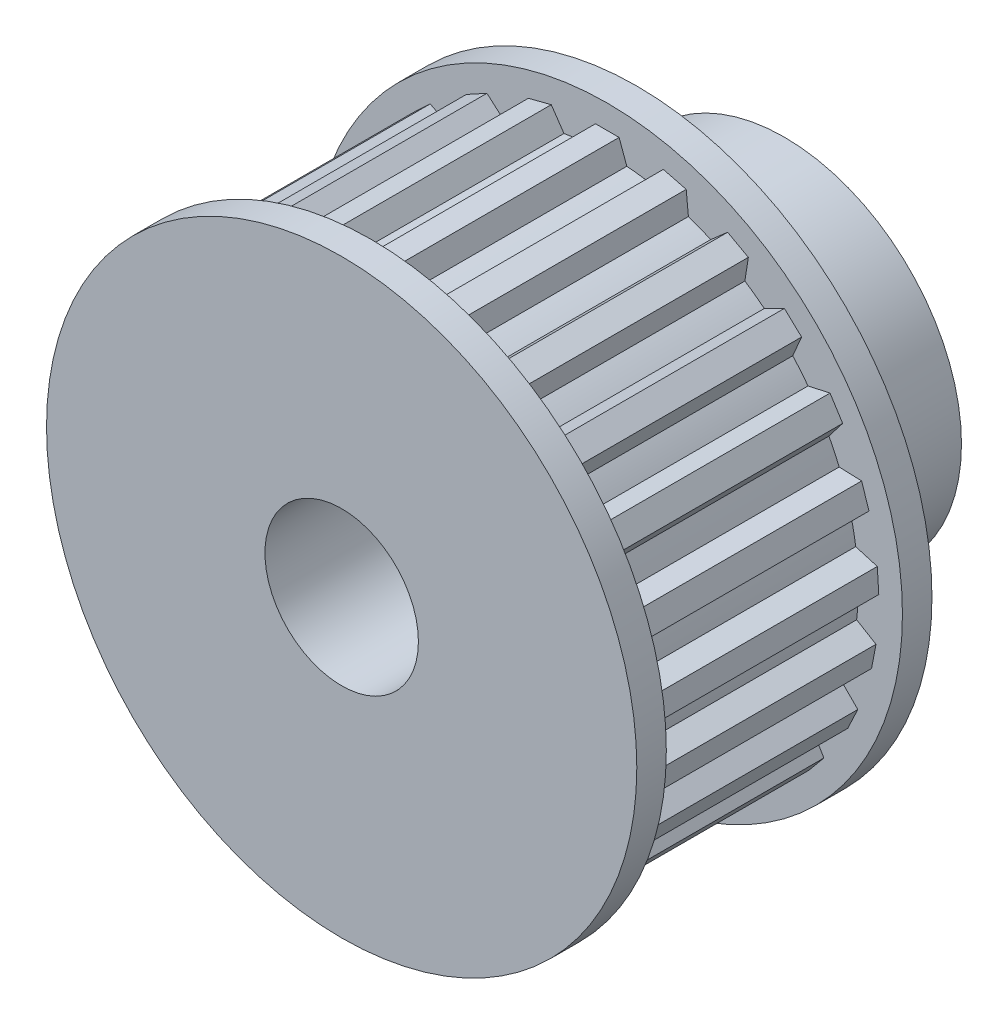
from build123d import *

# Parameters (mm, degrees)
BOSS_EXTRUDE1_DEPTH = 5
SKETCH2_R           = 10
BOSS_EXTRUDE2_DEPTH = 1
SKETCH4_R           = 6
BOSS_EXTRUDE3_DEPTH = 5
CUT_EXTRUDE1_REACH  = 22.616
SKETCH5_R           = 2.6


with BuildPart() as part:
    # Sketch1 → Boss-Extrude1 (new, symmetric)
    with BuildSketch(Plane.XY):
        with BuildLine():
            Line((-0.4, 9.191300234), (-0.660980834, 8.474261286))
            ThreePointArc((-0.660980834, 8.474261286), (-1.065332485, 8.432974961), (-1.467248177, 8.372406033))
            Line((-1.467248177, 8.372406033), (-1.898350154, 9.002014591))
            Line((-1.898350154, 9.002014591), (-2.673216683, 8.803062681))
            Line((-2.673216683, 8.803062681), (-2.747677989, 8.043647535))
            ThreePointArc((-2.747677989, 8.043647535), (-3.129058698, 7.90310013), (-3.503284589, 7.744481718))
            Line((-3.503284589, 7.744481718), (-4.077419986, 8.247099263))
            Line((-4.077419986, 8.247099263), (-4.77846533, 7.861696324))
            Line((-4.77846533, 7.861696324), (-4.66172843, 7.107621828))
            ThreePointArc((-4.66172843, 7.107621828), (-4.996174644, 6.876644452), (-5.319196746, 6.629943135))
            Line((-5.319196746, 6.629943135), (-6.000290524, 6.973988359))
            Line((-6.000290524, 6.973988359), (-6.583465426, 6.426350674))
            Line((-6.583465426, 6.426350674), (-6.282865329, 5.724998101))
            ThreePointArc((-6.282865329, 5.724998101), (-6.549362564, 5.418103913), (-6.80088421, 5.098820841))
            Line((-6.80088421, 5.098820841), (-7.546140742, 5.262676117))
            Line((-7.546140742, 5.262676117), (-7.974802178, 4.587213776))
            Line((-7.974802178, 4.587213776), (-7.509226693, 3.982651688))
            ThreePointArc((-7.509226693, 3.982651688), (-7.691029946, 3.619123978), (-7.855247106, 3.247320882))
            Line((-7.855247106, 3.247320882), (-8.617839183, 3.220690579))
            Line((-8.617839183, 3.220690579), (-8.865052779, 2.459845366))
            Line((-8.865052779, 2.459845366), (-8.263755727, 1.990060623))
            ThreePointArc((-8.263755727, 1.990060623), (-8.349441631, 1.592741174), (-8.416035937, 1.191779808))
            Line((-8.416035937, 1.191779808), (-9.148047095, 0.976337208))
            Line((-9.148047095, 0.976337208), (-9.198279511, 0.177915826))
            Line((-9.198279511, 0.177915826), (-8.499042597, -0.127573271))
            ThreePointArc((-8.499042597, -0.127573271), (-8.483227192, -0.533719416), (-8.448014278, -0.938645173))
            Line((-8.448014278, -0.938645173), (-9.103449564, -1.32936302))
            Line((-9.103449564, -1.32936302), (-8.953544512, -2.115192821))
            Line((-8.953544512, -2.115192821), (-8.200303363, -2.237191266))
            ThreePointArc((-8.200303363, -2.237191266), (-8.083980389, -2.626644452), (-7.949172812, -3.010091627))
            Line((-7.949172812, -3.010091627), (-8.486848816, -3.551534481))
            Line((-8.486848816, -3.551534481), (-8.146225383, -4.275396123))
            Line((-8.146225383, -4.275396123), (-7.38630891, -4.206238307))
            ThreePointArc((-7.38630891, -4.206238307), (-7.176787367, -4.554527757), (-6.950855584, -4.892402953))
            Line((-6.950855584, -4.892402953), (-7.336988145, -5.550549969))
            Line((-7.336988145, -5.550549969), (-6.827048953, -6.166960564))
            Line((-6.827048953, -6.166960564), (-6.108205503, -5.910991925))
            ThreePointArc((-6.108205503, -5.910991925), (-5.8186504, -6.196233333), (-5.515790536, -6.467306608))
            Line((-5.515790536, -6.467306608), (-5.726117525, -7.200803989))
            Line((-5.726117525, -7.200803989), (-5.078903929, -7.671032191))
            Line((-5.078903929, -7.671032191), (-4.44630108, -7.244336181))
            ThreePointArc((-4.44630108, -7.244336181), (-4.09490623, -7.44860678), (-3.734148082, -7.635845605))
            Line((-3.734148082, -7.635845605), (-3.755453882, -8.398605012))
            Line((-3.755453882, -8.398605012), (-3.011632693, -8.693104654))
            Line((-3.011632693, -8.693104654), (-2.505019208, -8.122492153))
            ThreePointArc((-2.505019208, -8.122492153), (-2.113864041, -8.23295687), (-1.717875372, -8.324596339))
            Line((-1.717875372, -8.324596339), (-1.54882126, -9.068690793))
            Line((-1.54882126, -9.068690793), (-0.755129499, -9.16895738))
            Line((-0.755129499, -9.16895738), (-0.406337766, -8.49028207))
            ThreePointArc((-0.406337766, -8.49028207), (0, -8.5), (0.406337766, -8.49028207))
            Line((0.406337766, -8.49028207), (0.755129499, -9.16895738))
            Line((0.755129499, -9.16895738), (1.54882126, -9.068690793))
            Line((1.54882126, -9.068690793), (1.717875372, -8.324596339))
            ThreePointArc((1.717875372, -8.324596339), (2.113864041, -8.23295687), (2.505019208, -8.122492153))
            Line((2.505019208, -8.122492153), (3.011632693, -8.693104654))
            Line((3.011632693, -8.693104654), (3.755453882, -8.398605012))
            Line((3.755453882, -8.398605012), (3.734148082, -7.635845605))
            ThreePointArc((3.734148082, -7.635845605), (4.09490623, -7.44860678), (4.44630108, -7.244336181))
            Line((4.44630108, -7.244336181), (5.078903929, -7.671032191))
            Line((5.078903929, -7.671032191), (5.726117525, -7.200803989))
            Line((5.726117525, -7.200803989), (5.515790536, -6.467306608))
            ThreePointArc((5.515790536, -6.467306608), (5.8186504, -6.196233333), (6.108205503, -5.910991925))
            Line((6.108205503, -5.910991925), (6.827048953, -6.166960564))
            Line((6.827048953, -6.166960564), (7.336988145, -5.550549969))
            Line((7.336988145, -5.550549969), (6.950855584, -4.892402953))
            ThreePointArc((6.950855584, -4.892402953), (7.176787367, -4.554527757), (7.38630891, -4.206238307))
            Line((7.38630891, -4.206238307), (8.146225383, -4.275396123))
            Line((8.146225383, -4.275396123), (8.486848816, -3.551534481))
            Line((8.486848816, -3.551534481), (7.949172812, -3.010091627))
            ThreePointArc((7.949172812, -3.010091627), (8.083980389, -2.626644452), (8.200303363, -2.237191266))
            Line((8.200303363, -2.237191266), (8.953544512, -2.115192821))
            Line((8.953544512, -2.115192821), (9.103449564, -1.32936302))
            Line((9.103449564, -1.32936302), (8.448014278, -0.938645173))
            ThreePointArc((8.448014278, -0.938645173), (8.483227192, -0.533719416), (8.499042597, -0.127573271))
            Line((8.499042597, -0.127573271), (9.198279511, 0.177915826))
            Line((9.198279511, 0.177915826), (9.148047095, 0.976337208))
            Line((9.148047095, 0.976337208), (8.416035937, 1.191779808))
            ThreePointArc((8.416035937, 1.191779808), (8.349441631, 1.592741174), (8.263755727, 1.990060623))
            Line((8.263755727, 1.990060623), (8.865052779, 2.459845366))
            Line((8.865052779, 2.459845366), (8.617839183, 3.220690579))
            Line((8.617839183, 3.220690579), (7.855247106, 3.247320882))
            ThreePointArc((7.855247106, 3.247320882), (7.691029946, 3.619123978), (7.509226693, 3.982651688))
            Line((7.509226693, 3.982651688), (7.974802178, 4.587213776))
            Line((7.974802178, 4.587213776), (7.546140742, 5.262676117))
            Line((7.546140742, 5.262676117), (6.80088421, 5.098820841))
            ThreePointArc((6.80088421, 5.098820841), (6.549362564, 5.418103913), (6.282865329, 5.724998101))
            Line((6.282865329, 5.724998101), (6.583465426, 6.426350674))
            Line((6.583465426, 6.426350674), (6.000290524, 6.973988359))
            Line((6.000290524, 6.973988359), (5.319196746, 6.629943135))
            ThreePointArc((5.319196746, 6.629943135), (4.996174644, 6.876644452), (4.66172843, 7.107621828))
            Line((4.66172843, 7.107621828), (4.77846533, 7.861696324))
            Line((4.77846533, 7.861696324), (4.077419986, 8.247099263))
            Line((4.077419986, 8.247099263), (3.503284589, 7.744481718))
            ThreePointArc((3.503284589, 7.744481718), (3.129058698, 7.90310013), (2.747677989, 8.043647535))
            Line((2.747677989, 8.043647535), (2.673216683, 8.803062681))
            Line((2.673216683, 8.803062681), (1.898350154, 9.002014591))
            Line((1.898350154, 9.002014591), (1.467248177, 8.372406033))
            ThreePointArc((1.467248177, 8.372406033), (1.065332485, 8.432974961), (0.660980834, 8.474261286))
            Line((0.660980834, 8.474261286), (0.4, 9.191300234))
            Line((0.4, 9.191300234), (-0.4, 9.191300234))
        make_face()
    extrude(amount=BOSS_EXTRUDE1_DEPTH, both=True)

    # Sketch2 → Boss-Extrude2 (add)
    with BuildSketch(Plane.XY.offset(5)):
        Circle(SKETCH2_R)
    boss_extrude2 = extrude(amount=-BOSS_EXTRUDE2_DEPTH)

    # Mirror1: Boss-Extrude2 across plane
    add(boss_extrude2.mirror(Plane.XY))

    # Sketch4 → Boss-Extrude3 (add)
    with BuildSketch(Plane(origin=(0, 0, -5), x_dir=(-1, 0, 0), z_dir=(0, 0, -1))):
        Circle(SKETCH4_R)
    extrude(amount=BOSS_EXTRUDE3_DEPTH)

    # Sketch5 → Cut-Extrude1 (cut, up to next)
    with BuildSketch(Plane.XY.offset(5), mode=Mode.PRIVATE) as cut_extrude1_sk1:
        Circle(SKETCH5_R)
    cut_extrude1_tool1 = extrude(cut_extrude1_sk1.sketch, amount=-CUT_EXTRUDE1_REACH, mode=Mode.PRIVATE) & part.part
    add(cut_extrude1_tool1.solids().sort_by_distance((0, 0, 5))[0], mode=Mode.SUBTRACT)


solid = part.part
